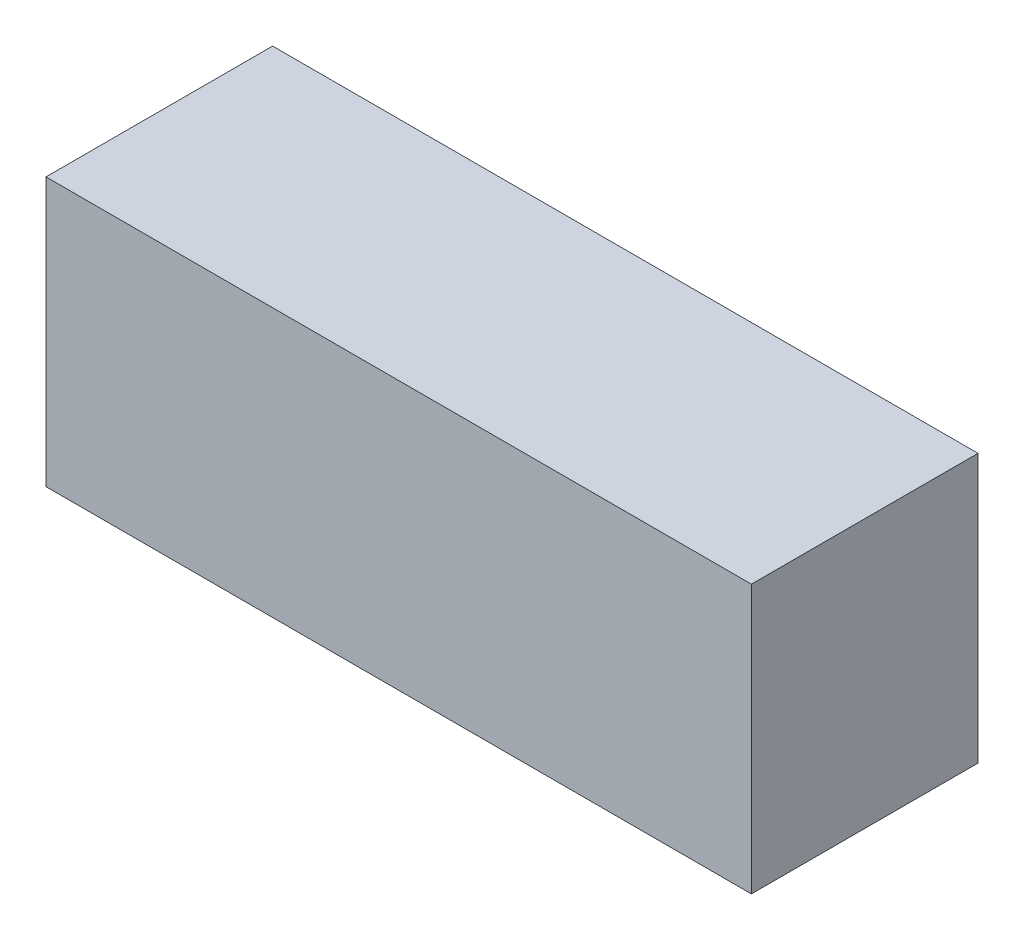
from build123d import *

# Parameters (mm, degrees)
SKETCH1_W               = 7.9068676
SKETCH1_H               = 3.0071822
COMPONENT_OUTLINE_DEPTH = 2.54


with BuildPart() as part:
    # Sketch1 → Component_Outline (new body)
    with BuildSketch(Plane.XY):
        with Locations((2.583434, -0.0303911)):
            Rectangle(SKETCH1_W, SKETCH1_H)
    extrude(amount=COMPONENT_OUTLINE_DEPTH)


solid = part.part
